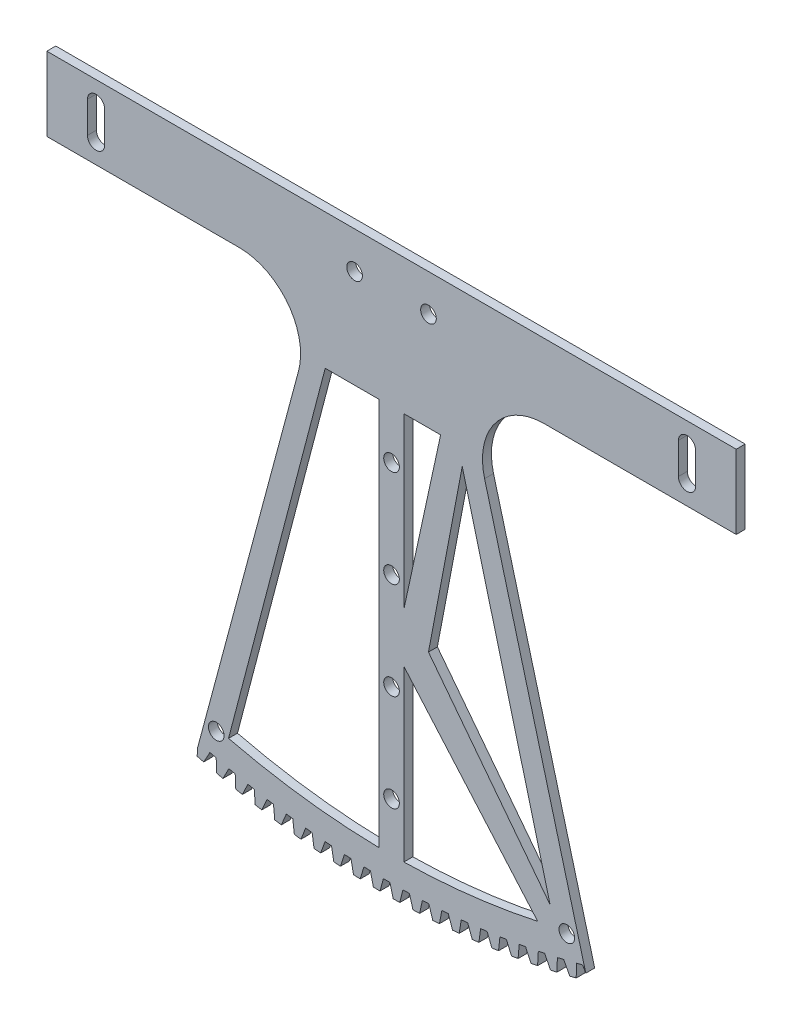
from build123d import *

# Parameters (mm, degrees)
BOSS_EXTRUDE2_DEPTH = 3.628571429
FILLET1_R           = 25
BOSS_EXTRUDE4_DEPTH = 3.628571429
CUT_EXTRUDE2_DEPTH  = 336.434355024
CIRPATTERN8_COUNT   = 20
CIRPATTERN8_ANGLE   = 28.5
SKETCH5_R           = 3.175
CUT_EXTRUDE3_DEPTH  = 338.743409804
SKETCH17_R          = 3.175
CUT_EXTRUDE4_DEPTH  = 338.743409804


with BuildPart() as part:
    # Sketch3 → Boss-Extrude2 (new body)
    with BuildSketch(Plane.XY):
        with BuildLine():
            Line((-140, -79.56), (-140, -109.56))
            Line((-140, -109.56), (-29.356513523, -109.56))
            Line((-29.356513523, -109.56), (-78.888044947, -294.414191853))
            ThreePointArc((-78.888044947, -294.414191853), (0, -304.8), (78.888044947, -294.414191853))
            Line((78.888044947, -294.414191853), (29.356513523, -109.56))
            Line((29.356513523, -109.56), (140, -109.56))
            Line((140, -109.56), (140, -79.56))
            Line((140, -79.56), (-140, -79.56))
        make_face()
    extrude(amount=BOSS_EXTRUDE2_DEPTH)

    # Fillet1
    fillet1_edges = [part.edges().sort_by_distance(p)[0] for p in [
        (29.356513523, -109.56, 1.814285714),
        (-29.356513523, -109.56, 1.814285714),
    ]]
    fillet(fillet1_edges, radius=FILLET1_R)

    # Sketch14 → Boss-Extrude4 (add)
    with BuildSketch(Plane(origin=(0, 0, 0), x_dir=(-1, 0, 0), z_dir=(0, 0, -1))):
        with BuildLine():
            Line((78.910933272, -297.036934084), (78.888044947, -294.414191853))
            ThreePointArc((78.888044947, -294.414191853), (76.959432674, -294.924203351), (75.027523715, -295.421581279))
            Line((75.027523715, -295.421581279), (76.289081309, -297.721097125))
            Line((76.289081309, -297.721097125), (78.910933272, -297.036934084))
        make_face()
    boss_extrude4 = extrude(amount=-BOSS_EXTRUDE4_DEPTH)

    # Sketch16 → Cut-Extrude2 (cut, symmetric)
    with BuildSketch(Plane(origin=(0, 0, 0), x_dir=(-1, 0, 0), z_dir=(0, 0, -1))):
        Polygon((372.937709596, -838.440145613), (75.027523715, -295.421581279), (73.765262731, -293.12078332), (71.19993834, -293.754449124), (71.154137831, -296.378353915), (60.344615656, -915.654378233), (357.400151379, -2118.250141136), (669.993245319, -2041.035908516), align=None)
    cut_extrude2 = extrude(amount=CUT_EXTRUDE2_DEPTH, both=True, mode=Mode.SUBTRACT)

    # CirPattern8: Boss-Extrude4, Cut-Extrude2 ×20 about axis
    cirpattern8_axis = Axis((0, 0, 0), (0, 0, 1))
    add([boss_extrude4.rotate(cirpattern8_axis, i * CIRPATTERN8_ANGLE / (CIRPATTERN8_COUNT - 1)) for i in range(1, CIRPATTERN8_COUNT)])
    add([cut_extrude2.rotate(cirpattern8_axis, i * CIRPATTERN8_ANGLE / (CIRPATTERN8_COUNT - 1)) for i in range(1, CIRPATTERN8_COUNT)], mode=Mode.SUBTRACT)

    # Sketch5 → Cut-Extrude3 (cut, through all)
    with BuildSketch(Plane(origin=(0, 0, 0), x_dir=(-1, 0, 0), z_dir=(0, 0, -1))):
        with Locations((-15, -94.56)):
            Circle(SKETCH5_R)
        with Locations((15, -94.56)):
            Circle(SKETCH5_R)
        with BuildLine():
            Line((-123.5, -94.56), (-123.5, -100.91))
            ThreePointArc((-123.5, -100.91), (-120, -104.41), (-116.5, -100.91))
            Line((-116.5, -100.91), (-116.5, -94.56))
            Line((-116.5, -94.56), (-116.5, -88.21))
            ThreePointArc((-116.5, -88.21), (-120, -84.71), (-123.5, -88.21))
            Line((-123.5, -88.21), (-123.5, -94.56))
        make_face()
        with BuildLine():
            Line((116.5, -94.56), (116.5, -88.21))
            ThreePointArc((116.5, -88.21), (120, -84.71), (123.5, -88.21))
            Line((123.5, -88.21), (123.5, -94.56))
            Line((123.5, -94.56), (123.5, -100.91))
            ThreePointArc((123.5, -100.91), (120, -104.41), (116.5, -100.91))
            Line((116.5, -100.91), (116.5, -94.56))
        make_face()
    extrude(amount=-CUT_EXTRUDE3_DEPTH, mode=Mode.SUBTRACT)

    # Sketch17 → Cut-Extrude4 (cut, through all)
    with BuildSketch(Plane(origin=(0, 0, 0), x_dir=(-1, 0, 0), z_dir=(0, 0, -1))):
        with BuildLine():
            Line((66.194365296, -284.361242536), (26.937147844, -134.56))
            Line((26.937147844, -134.56), (5, -134.56))
            Line((5, -134.56), (5, -292.259285824))
            ThreePointArc((5, -292.259285824), (35.815557854, -290.00224429), (66.194365296, -284.361242536))
        make_face()
        Polygon((-28.711660115, -141.33134449), (-64.419853025, -277.589898046), (-15, -213.409642912), align=None)
        with BuildLine():
            Line((-5, -223.409642912), (-59.372890863, -285.932066063))
            ThreePointArc((-59.372890863, -285.932066063), (-32.341547535, -290.428544105), (-5, -292.259285824))
            Line((-5, -292.259285824), (-5, -223.409642912))
        make_face()
        Polygon((-19.937147844, -134.56), (-5, -203.409642912), (-5, -134.56), align=None)
        with Locations((0, -272.546875096)):
            Circle(SKETCH17_R)
        with Locations((0, -233.12205364)):
            Circle(SKETCH17_R)
        with Locations((0, -193.697232184)):
            Circle(SKETCH17_R)
        with Locations((0, -154.272410728)):
            Circle(SKETCH17_R)
        with Locations((-71.194365296, -284.361242536)):
            Circle(SKETCH17_R)
        with Locations((71.194365296, -284.361242536)):
            Circle(SKETCH17_R)
    extrude(amount=-CUT_EXTRUDE4_DEPTH, mode=Mode.SUBTRACT)


solid = part.part
